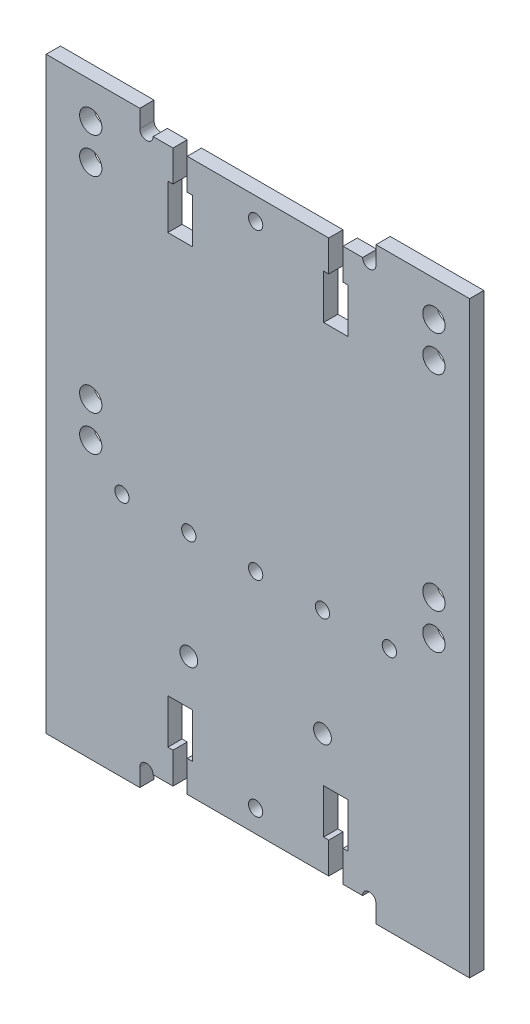
from build123d import *

# Parameters (mm, degrees)
MODEL_R             = 2.5
MODEL_R_2           = 2
MODEL_R_3           = 1.6
BOSS_EXTRUDE1_DEPTH = 3.2
SKETCH1_R           = 1.5005
CUT_EXTRUDE1_DEPTH  = 85.084719183


with BuildPart() as part:
    # Model → Boss-Extrude1 (new body)
    with BuildSketch(Plane.XY):
        Polygon((15.75, 55), (15.75, 45), (10.25, 45), (10.25, 55), (11.4, 55), (11.4, 62), (-20.35, 62), (-20.35, 55), (-19.2, 55), (-19.2, 45), (-24.7, 45), (-24.7, 55), (-23.55, 55), (-23.55, 62), (-31, 62), (-31, 66), (-52, 66), (-52, -66), (-31, -66), (-31, -62), (-23.55, -62), (-23.55, -55), (-24.7, -55), (-24.7, -45), (-19.2, -45), (-19.2, -55), (-20.35, -55), (-20.35, -62), (11.4, -62), (11.4, -55), (10.25, -55), (10.25, -45), (15.75, -45), (15.75, -55), (14.6, -55), (14.6, -62), (22, -62), (22, -66), (43, -66), (43, 66), (22, 66), (22, 62), (14.6, 62), (14.6, 55), align=None)
        with Locations((-42, -4)):
            Circle(MODEL_R, mode=Mode.SUBTRACT)
        with Locations((-42, 58)):
            Circle(MODEL_R, mode=Mode.SUBTRACT)
        with Locations((35, 50)):
            Circle(MODEL_R, mode=Mode.SUBTRACT)
        with Locations((35, -4)):
            Circle(MODEL_R, mode=Mode.SUBTRACT)
        with Locations((35, 58)):
            Circle(MODEL_R, mode=Mode.SUBTRACT)
        with Locations((35, 4)):
            Circle(MODEL_R, mode=Mode.SUBTRACT)
        with Locations((-42, 4)):
            Circle(MODEL_R, mode=Mode.SUBTRACT)
        with Locations((-42, 50)):
            Circle(MODEL_R, mode=Mode.SUBTRACT)
        with Locations((-20, -35)):
            Circle(MODEL_R_2, mode=Mode.SUBTRACT)
        with Locations((10, -35)):
            Circle(MODEL_R_2, mode=Mode.SUBTRACT)
        with Locations((10, -11)):
            Circle(MODEL_R_3, mode=Mode.SUBTRACT)
        with Locations((25, -11)):
            Circle(MODEL_R_3, mode=Mode.SUBTRACT)
        with Locations((-5, 57)):
            Circle(MODEL_R_3, mode=Mode.SUBTRACT)
        with Locations((-5, -57)):
            Circle(MODEL_R_3, mode=Mode.SUBTRACT)
        with Locations((-35, -11)):
            Circle(MODEL_R_3, mode=Mode.SUBTRACT)
        with Locations((-20, -11)):
            Circle(MODEL_R_3, mode=Mode.SUBTRACT)
        with Locations((-5, -11)):
            Circle(MODEL_R_3, mode=Mode.SUBTRACT)
    extrude(amount=BOSS_EXTRUDE1_DEPTH)

    # Sketch1 → Cut-Extrude1 (cut, through all)
    with BuildSketch(Plane.XY.offset(3.2)):
        with Locations((-29.4995, 62)):
            Circle(SKETCH1_R)
        with Locations((20.4995, 62)):
            Circle(SKETCH1_R)
        with Locations((20.4995, -62)):
            Circle(SKETCH1_R)
        with Locations((-29.4995, -62)):
            Circle(SKETCH1_R)
    extrude(amount=-CUT_EXTRUDE1_DEPTH, mode=Mode.SUBTRACT)


solid = part.part
